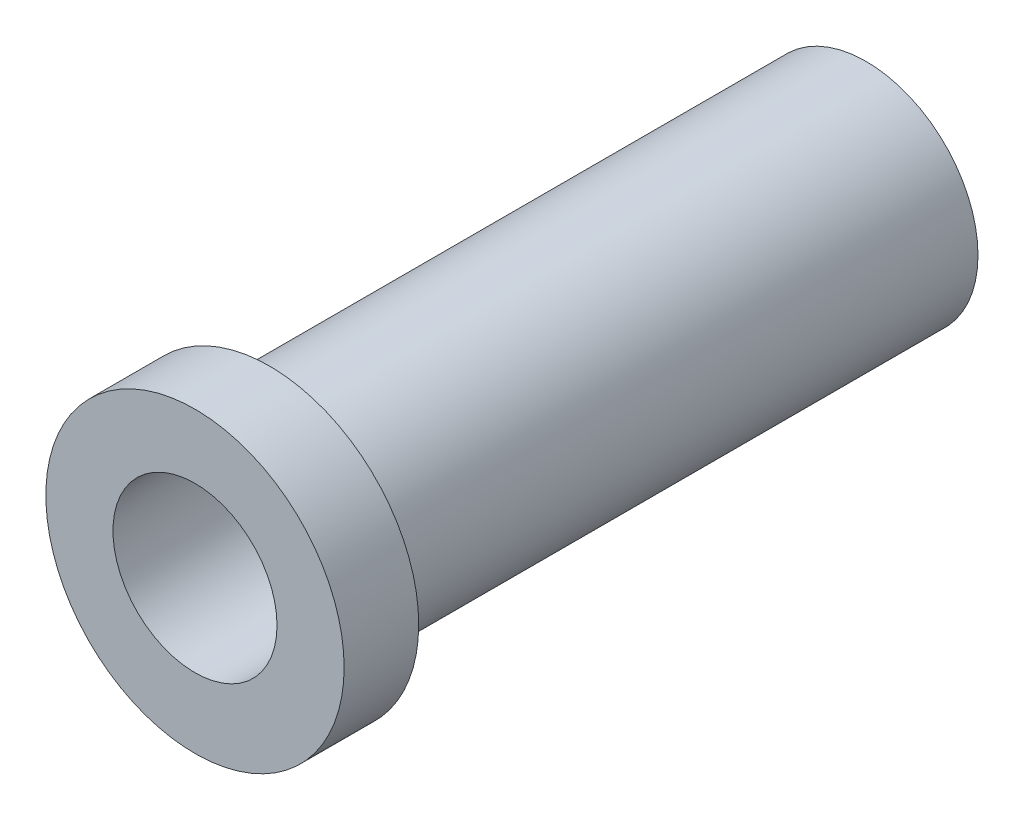
from build123d import *

# Parameters (mm, degrees)
SKETCH1_R           = 7.5
SKETCH1_R_2         = 5.5
BOSS_EXTRUDE1_DEPTH = 40
BOSS_EXTRUDE2_START = 5
SKETCH1_3_R         = 10
SKETCH1_3_R_2       = 5.5
BOSS_EXTRUDE2_DEPTH = 5


with BuildPart() as part:
    # Sketch1 → Boss-Extrude1 (new body)
    with BuildSketch(Plane.XY):
        Circle(SKETCH1_R)
        Circle(SKETCH1_R_2, mode=Mode.SUBTRACT)
    extrude(amount=-BOSS_EXTRUDE1_DEPTH)

    # Sketch1<3> → Boss-Extrude2 (add)
    with BuildSketch(Plane.XY.offset(BOSS_EXTRUDE2_START)):
        with Locations((0, -0.190863113)):
            Circle(SKETCH1_3_R)
        Circle(SKETCH1_3_R_2, mode=Mode.SUBTRACT)
    extrude(amount=-BOSS_EXTRUDE2_DEPTH)


solid = part.part
